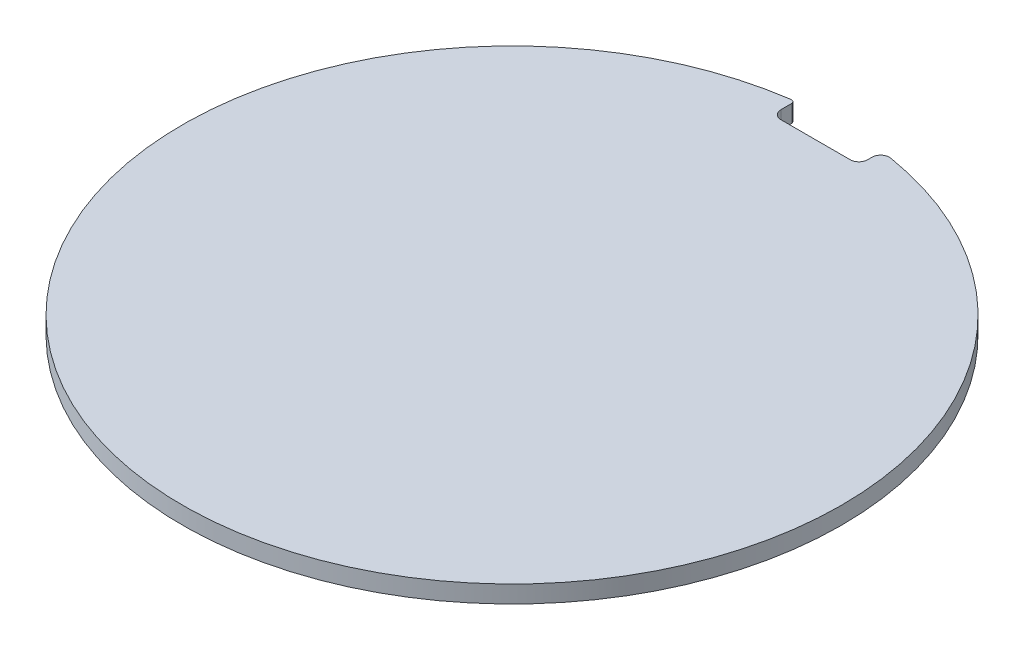
from build123d import *

# Parameters (mm, degrees)
BOSS_EXTRUDE1_DEPTH = 1


with BuildPart() as part:
    # Sketch1 → Boss-Extrude1 (new body)
    with BuildSketch(Plane(origin=(0, 0, 0), x_dir=(1, 0, 0), z_dir=(0, 1, 0))):
        with BuildLine():
            Line((2.5, 18.255136264), (2.5, 18))
            ThreePointArc((2.5, 18), (2.353553391, 17.646446609), (2, 17.5))
            Line((2, 17.5), (-2, 17.5))
            ThreePointArc((-2, 17.5), (-2.353553391, 17.646446609), (-2.5, 18))
            Line((-2.5, 18), (-2.5, 18.605106826))
            ThreePointArc((-2.5, 18.605106826), (-2.569127315, 18.756342868), (-2.728723404, 18.803033494))
            ThreePointArc((-2.728723404, 18.803033494), (-0.178274953, -18.999163614), (3.081081081, 18.748518325))
            ThreePointArc((3.081081081, 18.748518325), (2.67638027, 18.636279636), (2.5, 18.255136264))
        make_face()
    extrude(amount=BOSS_EXTRUDE1_DEPTH)


solid = part.part
